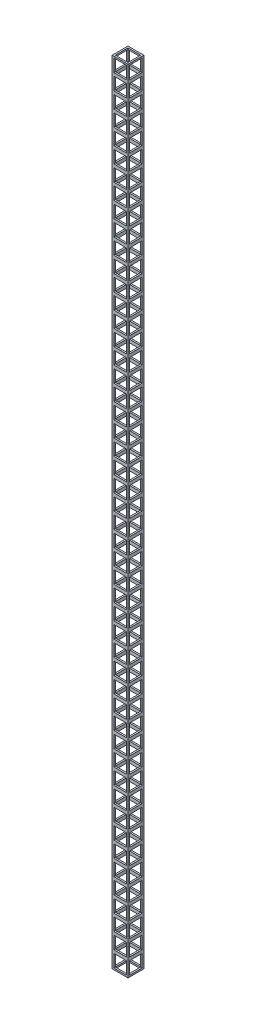
from build123d import *

# Parameters (mm, degrees)
SKIZZE1_W                       = 50
SKIZZE1_H                       = 2500
AUFSATZ_LINEAR_AUSTRAGEN1_DEPTH = 50
SKIZZE2_W                       = 40
SKIZZE2_H                       = 40
SCHNITT_LINEAR_AUSTRAGEN1_DEPTH = 2501.99980008
SKIZZE3_W                       = 40
SKIZZE3_H                       = 40
SCHNITT_LINEAR_AUSTRAGEN2_DEPTH = 2501.99980008
SKIZZE4_W                       = 40
SKIZZE4_H                       = 40
SCHNITT_LINEAR_AUSTRAGEN3_DEPTH = 2501.99980008
LINEARES_MUSTER1_COUNT          = 50
LINEARES_MUSTER1_PITCH          = 50
LINEARES_MUSTER2_COUNT          = 50
LINEARES_MUSTER2_PITCH          = 50


with BuildPart() as part:
    # Skizze1 → Aufsatz-Linear austragen1 (new body)
    with BuildSketch(Plane.XY):
        with Locations((25, 1250)):
            Rectangle(SKIZZE1_W, SKIZZE1_H)
    extrude(amount=AUFSATZ_LINEAR_AUSTRAGEN1_DEPTH)

    # Skizze2 → Schnitt-Linear austragen1 (cut, through all)
    with BuildSketch(Plane(origin=(0, 2500, 0), x_dir=(1, 0, 0), z_dir=(0, 1, 0))):
        with Locations((25, -25)):
            Rectangle(SKIZZE2_W, SKIZZE2_H)
    extrude(amount=-SCHNITT_LINEAR_AUSTRAGEN1_DEPTH, mode=Mode.SUBTRACT)

    # Skizze3 → Schnitt-Linear austragen2 (cut, symmetric)
    with BuildSketch(Plane.XY.offset(50)):
        with Locations((25, 2475)):
            Rectangle(SKIZZE3_W, SKIZZE3_H)
    schnitt_linear_austragen2 = extrude(amount=SCHNITT_LINEAR_AUSTRAGEN2_DEPTH, both=True, mode=Mode.SUBTRACT)

    # Skizze4 → Schnitt-Linear austragen3 (cut, symmetric)
    with BuildSketch(Plane(origin=(50, 0, 0), x_dir=(0, 0, -1), z_dir=(1, 0, 0))):
        with Locations((-25, 2475)):
            Rectangle(SKIZZE4_W, SKIZZE4_H)
    schnitt_linear_austragen3 = extrude(amount=SCHNITT_LINEAR_AUSTRAGEN3_DEPTH, both=True, mode=Mode.SUBTRACT)

    # Lineares Muster1: Schnitt-Linear austragen2 ×50
    with Locations(*[(0, -i * LINEARES_MUSTER1_PITCH, 0) for i in range(1, LINEARES_MUSTER1_COUNT)]):
        add(schnitt_linear_austragen2, mode=Mode.SUBTRACT)

    # Lineares Muster2: Schnitt-Linear austragen3 ×50
    with Locations(*[(0, -i * LINEARES_MUSTER2_PITCH, 0) for i in range(1, LINEARES_MUSTER2_COUNT)]):
        add(schnitt_linear_austragen3, mode=Mode.SUBTRACT)


solid = part.part
